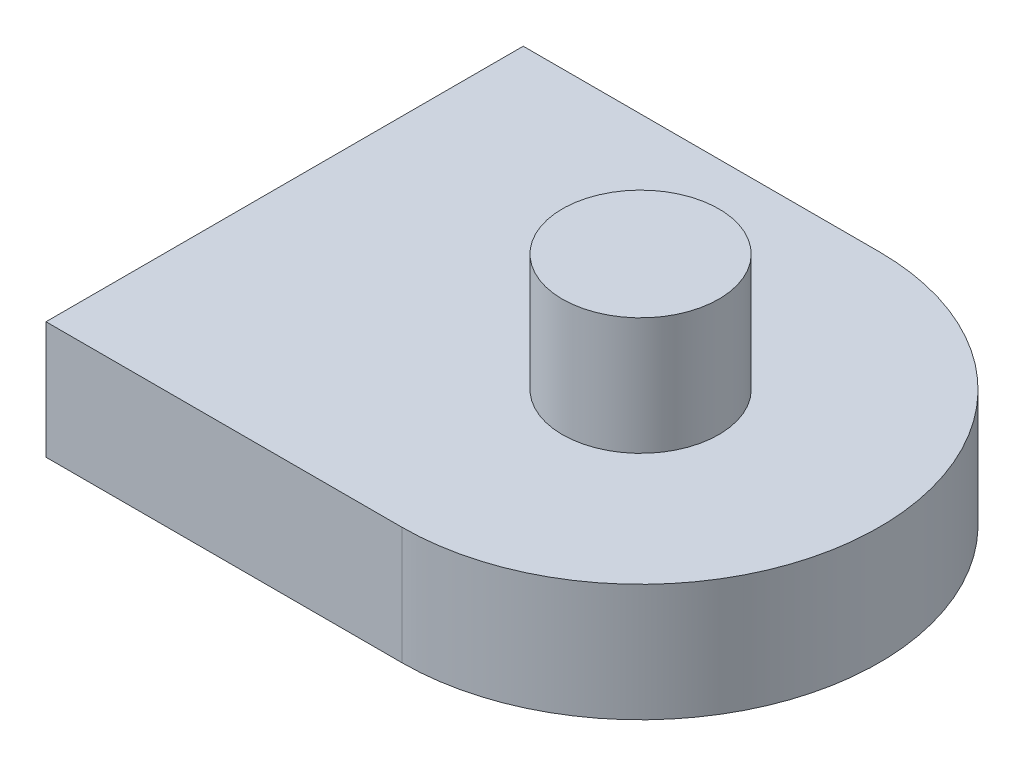
from build123d import *

# Parameters (mm, degrees)
BOSS_EXTRUDE1_DEPTH = 3
SKETCH4_R           = 2
BOSS_EXTRUDE2_DEPTH = 3


with BuildPart() as part:
    # Sketch3 → Boss-Extrude1 (new body)
    with BuildSketch(Plane(origin=(0, 0, 0), x_dir=(1, 0, 0), z_dir=(0, 1, 0))):
        with BuildLine():
            Line((-20.336842105, 8.293859649), (-11.236842105, 8.293859649))
            ThreePointArc((-11.236842105, 8.293859649), (-5.136842105, 2.193859649), (-11.236842105, -3.906140351))
            Line((-11.236842105, -3.906140351), (-20.336842105, -3.906140351))
            Line((-20.336842105, -3.906140351), (-20.336842105, 8.293859649))
        make_face()
    extrude(amount=BOSS_EXTRUDE1_DEPTH)

    # Sketch4 → Boss-Extrude2 (add)
    with BuildSketch(Plane(origin=(0, 3, 0), x_dir=(1, 0, 0), z_dir=(0, 1, 0))):
        with Locations(Location((-11.236842105, 2.193859649, 0), (0, 0, 270))):
            Circle(SKETCH4_R)
    extrude(amount=BOSS_EXTRUDE2_DEPTH)


solid = part.part
